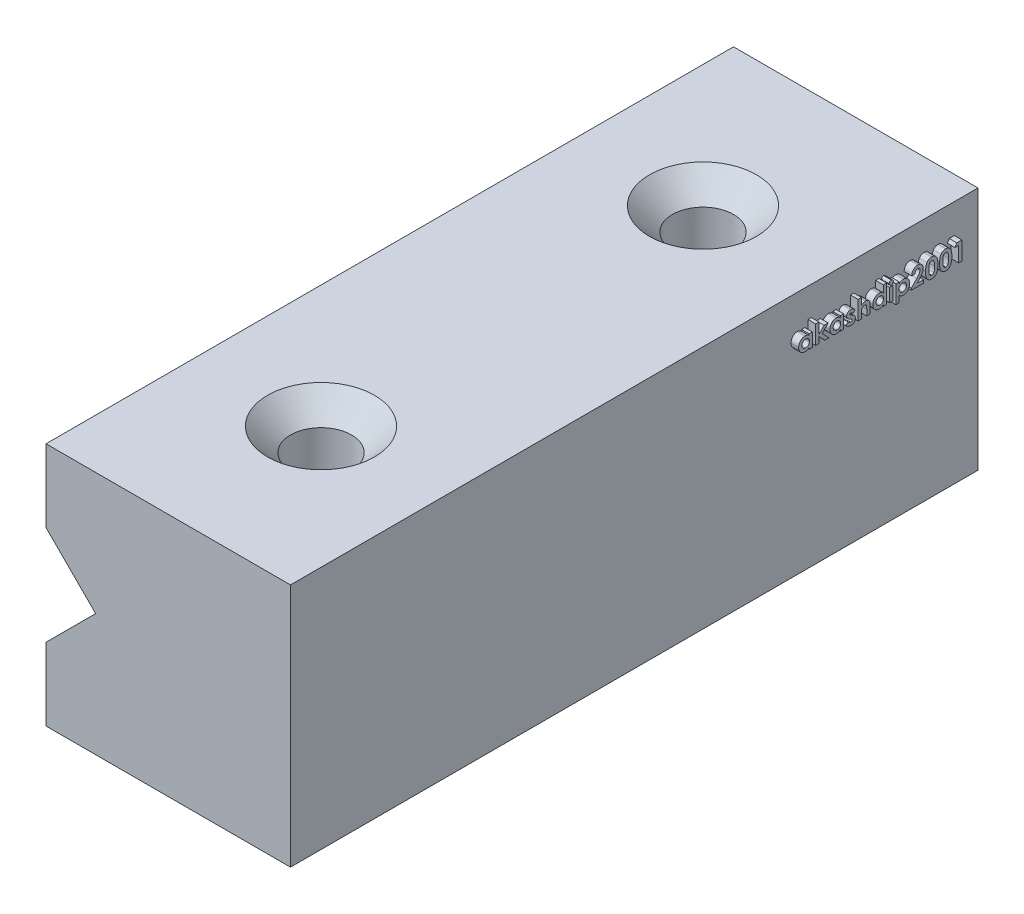
from build123d import *

# Parameters (mm, degrees)
BOSS_EXTRUDE1_DEPTH   = 45
F_8_0MM_DOWEL_HOLE1_D = 8
CHAMFER1_SIZE         = 3
SKETCH8_W             = 0.427403847
SKETCH8_H             = 1.74014423
BOSS_EXTRUDE2_DEPTH   = 1


with BuildPart() as part:
    # Sketch2 → Boss-Extrude1 (new, symmetric)
    with BuildSketch(Plane.XY):
        Polygon((-16, -6.5), (-16, -16), (16, -16), (16, 16), (-16, 16), (-16, 6.5), (-9.5, 0), align=None)
    extrude(amount=BOSS_EXTRUDE1_DEPTH, both=True)

    # Ø8.0mm Dowel Hole1 (through all)
    with Locations(Plane(origin=(0, 16, 0), x_dir=(1, 0, 0), z_dir=(0, 1, 0))):
        with Locations((0, -25), (0, 25)):
            Hole(F_8_0MM_DOWEL_HOLE1_D / 2)

    # Chamfer1
    chamfer1_edges = [part.edges().sort_by_distance(p)[0] for p in [
        (4, 16, -25),
        (4, 16, 25),
    ]]
    chamfer(chamfer1_edges, length=CHAMFER1_SIZE)

    # Sketch8 → Boss-Extrude2 (add, symmetric)
    # profile 1 of 13: a face of its own
    with BuildSketch(Plane(origin=(16, 0, 0), x_dir=(0, 0, -1), z_dir=(1, 0, 0))):
        with BuildLine():
            Line((21.898857493, 11.512698723), (22.32626134, 11.512698723))
            Line((22.32626134, 11.512698723), (22.32626134, 9.772554493))
            Line((22.32626134, 9.772554493), (21.898857493, 9.772554493))
            Line((21.898857493, 9.772554493), (21.898857493, 9.962405755))
            add(Edge.make_bspline(
                [(21.898857493, 9.962405755), (21.87767979, 9.943925835), (21.836578051, 9.908059962), (21.771815009, 9.861523079), (21.706862722, 9.823136165), (21.641409093, 9.792563081), (21.574448126, 9.769988006), (21.505497729, 9.753643124), (21.433564944, 9.744004147), (21.384666028, 9.742692016), (21.359832553, 9.742025646)],
                knots=[0, 0, 0, 0, 1.129196829, 2.191548051, 3.199897424, 4.157751732, 5.089409408, 6.034969131, 7.002052659, 8, 8, 8, 8], degree=3))
            add(Edge.make_bspline(
                [(21.359832553, 9.742025646), (21.331955875, 9.742652785), (21.276869977, 9.743892045), (21.196037539, 9.75693726), (21.117985783, 9.776905869), (21.042778067, 9.805163948), (20.970551224, 9.841780877), (20.900752499, 9.885801271), (20.834578456, 9.938770508), (20.771478217, 9.998396746), (20.713704018, 10.063986031), (20.663197267, 10.134627993), (20.62062383, 10.209320734), (20.585745691, 10.28781661), (20.55830953, 10.370058012), (20.538751474, 10.456305783), (20.527212198, 10.546590728), (20.525783961, 10.608089296), (20.525059416, 10.639287515)],
                knots=[0, 0, 0, 0, 0.980476535, 1.937477201, 2.874147792, 3.812856188, 4.758993464, 5.720109578, 6.712210464, 7.737600662, 8.772720504, 9.783789959, 10.789002326, 11.793715968, 12.802552247, 13.835794126, 14.902098527, 16, 16, 16, 16], degree=3))
            add(Edge.make_bspline(
                [(20.525059416, 10.639287515), (20.525819829, 10.671593312), (20.527311462, 10.734964732), (20.538222672, 10.827959278), (20.557419808, 10.916345556), (20.583596484, 11.000245994), (20.617268232, 11.079675086), (20.658278171, 11.154762963), (20.707184204, 11.225313357), (20.763539736, 11.290125451), (20.82438987, 11.349528866), (20.889488755, 11.401244249), (20.957818389, 11.445178873), (21.029451382, 11.481046576), (21.104377506, 11.508763322), (21.182300953, 11.529026527), (21.263567648, 11.541185161), (21.31892718, 11.542541113), (21.346953196, 11.54322757)],
                knots=[0, 0, 0, 0, 1.136281865, 2.228943489, 3.287578264, 4.313574083, 5.316051562, 6.317280042, 7.318008486, 8.329309503, 9.333984563, 10.305318864, 11.248632312, 12.186624717, 13.117503092, 14.05354244, 15.014596925, 16, 16, 16, 16], degree=3))
            add(Edge.make_bspline(
                [(21.346953196, 11.54322757), (21.372914369, 11.542688221), (21.424282172, 11.541621044), (21.499785442, 11.530033546), (21.573012723, 11.512508277), (21.643564558, 11.487537924), (21.712019636, 11.456007773), (21.777200487, 11.416498145), (21.840533001, 11.370669609), (21.879175792, 11.334876553), (21.898857493, 11.316646289)],
                knots=[0, 0, 0, 0, 1.017011718, 2.012299608, 2.98747302, 3.965332399, 4.941441765, 5.936729654, 6.94912688, 8, 8, 8, 8], degree=3))
            Line((21.898857493, 11.316646289), (21.898857493, 11.512698723))
        make_face()
        with BuildLine():
            add(Edge.make_bspline(
                [(21.436631682, 11.14635257), (21.419600899, 11.145830006), (21.386221675, 11.144805817), (21.337132959, 11.138645243), (21.290218873, 11.127790039), (21.245814003, 11.111753806), (21.203256556, 11.092219338), (21.16319277, 11.067752737), (21.12529199, 11.038833736), (21.089777112, 11.006162461), (21.057400068, 10.970250757), (21.029489166, 10.931063308), (21.005769409, 10.889655991), (20.985708659, 10.84590431), (20.971349714, 10.799290548), (20.959977435, 10.750421531), (20.954075958, 10.698898026), (20.953006207, 10.663786353), (20.952463263, 10.645965701)],
                knots=[0, 0, 0, 0, 1.04836806, 2.054732945, 3.03993516, 4.00574415, 4.955904794, 5.917688631, 6.888591924, 7.88601754, 8.884115178, 9.859153345, 10.841239365, 11.818093293, 12.814750328, 13.83810466, 14.90274714, 16, 16, 16, 16], degree=3))
            add(Edge.make_bspline(
                [(20.952463263, 10.645965701), (20.952997913, 10.627983405), (20.954051435, 10.5925495), (20.960072856, 10.540591376), (20.971035913, 10.491008498), (20.987030601, 10.44420171), (21.006563824, 10.399539434), (21.030340149, 10.35722779), (21.059545201, 10.318014901), (21.091950627, 10.280972858), (21.128194087, 10.247895752), (21.166309326, 10.218526318), (21.206816967, 10.193952932), (21.249277532, 10.174092565), (21.293548096, 10.157908036), (21.340183677, 10.14718926), (21.388727423, 10.140336949), (21.421820976, 10.13938272), (21.438539735, 10.138900646)],
                knots=[0, 0, 0, 0, 1.099136573, 2.165835871, 3.191374663, 4.196217796, 5.183857741, 6.167377911, 7.154730987, 8.166690795, 9.170734848, 10.148332609, 11.103258353, 12.059567475, 13.009337315, 13.978056681, 14.978520572, 16, 16, 16, 16], degree=3))
            add(Edge.make_bspline(
                [(21.438539735, 10.138900646), (21.455887737, 10.139426139), (21.48989925, 10.140456391), (21.539788824, 10.146560742), (21.587333135, 10.157455748), (21.632334373, 10.173583792), (21.67547989, 10.192978042), (21.716380336, 10.216966546), (21.75459188, 10.245819186), (21.790308046, 10.27878581), (21.823035026, 10.314990755), (21.851331913, 10.354692086), (21.875979537, 10.396620045), (21.89536376, 10.441765964), (21.91075755, 10.489339998), (21.92180224, 10.539637402), (21.927809911, 10.592712404), (21.92885422, 10.628938161), (21.92938634, 10.64739674)],
                knots=[0, 0, 0, 0, 1.050008698, 2.058587853, 3.036635738, 3.995319155, 4.947022481, 5.895997462, 6.858296291, 7.838991643, 8.833936038, 9.806048392, 10.784806122, 11.771666913, 12.772873988, 13.80724452, 14.882696879, 16, 16, 16, 16], degree=3))
            add(Edge.make_bspline(
                [(21.92938634, 10.64739674), (21.928860832, 10.665537841), (21.927834362, 10.70097268), (21.921776331, 10.752939501), (21.91065323, 10.802249294), (21.895576269, 10.848992697), (21.875847195, 10.893062833), (21.851180922, 10.933971068), (21.823194435, 10.97313472), (21.79010512, 11.008361568), (21.754582437, 11.041089488), (21.715808931, 11.069069604), (21.675006176, 11.093183644), (21.631923482, 11.112982201), (21.58616192, 11.127495294), (21.538536359, 11.13873225), (21.488303741, 11.144802119), (21.454136778, 11.145827319), (21.436631682, 11.14635257)],
                knots=[0, 0, 0, 0, 1.106611376, 2.161533483, 3.185006901, 4.184773755, 5.152708835, 6.122342771, 7.094156588, 8.082475533, 9.064254463, 10.03606828, 10.992420271, 11.951521816, 12.920622147, 13.915721683, 14.932141191, 16, 16, 16, 16], degree=3))
        make_face(mode=Mode.SUBTRACT)
    # profile 2 of 13: a face of its own
    with BuildSketch(Plane(origin=(16, 0, 0), x_dir=(0, 0, -1), z_dir=(1, 0, 0))):
        Polygon((22.753665186, 12.214862185), (23.181069032, 12.214862185), (23.181069032, 10.790500707), (23.846025462, 11.512698723), (24.374556111, 11.512698723), (23.610380931, 10.683172732), (24.483315126, 9.772554493), (23.945244212, 9.772554493), (23.181069032, 10.569643585), (23.181069032, 9.772554493), (22.753665186, 9.772554493), align=None)
    # profile 3 of 13: a face of its own
    with BuildSketch(Plane(origin=(16, 0, 0), x_dir=(0, 0, -1), z_dir=(1, 0, 0))):
        with BuildLine():
            Line((25.989722878, 11.512698723), (26.417126724, 11.512698723))
            Line((26.417126724, 11.512698723), (26.417126724, 9.772554493))
            Line((26.417126724, 9.772554493), (25.989722878, 9.772554493))
            Line((25.989722878, 9.772554493), (25.989722878, 9.962405755))
            add(Edge.make_bspline(
                [(25.989722878, 9.962405755), (25.968545175, 9.943925835), (25.927443435, 9.908059962), (25.862680394, 9.861523079), (25.797728107, 9.823136165), (25.732274477, 9.792563081), (25.66531351, 9.769988006), (25.596363114, 9.753643124), (25.524430329, 9.744004147), (25.475531412, 9.742692016), (25.450697938, 9.742025646)],
                knots=[0, 0, 0, 0, 1.129196829, 2.191548051, 3.199897424, 4.157751732, 5.089409408, 6.034969131, 7.002052659, 8, 8, 8, 8], degree=3))
            add(Edge.make_bspline(
                [(25.450697938, 9.742025646), (25.422821259, 9.742652785), (25.367735362, 9.743892045), (25.286902923, 9.75693726), (25.208851168, 9.776905869), (25.133643452, 9.805163948), (25.061416608, 9.841780877), (24.991617884, 9.885801271), (24.92544384, 9.938770508), (24.862343602, 9.998396746), (24.804569402, 10.063986031), (24.754062652, 10.134627993), (24.711489214, 10.209320734), (24.676611075, 10.28781661), (24.649174915, 10.370058012), (24.629616859, 10.456305783), (24.618077583, 10.546590728), (24.616649346, 10.608089296), (24.615924801, 10.639287515)],
                knots=[0, 0, 0, 0, 0.980476535, 1.937477201, 2.874147792, 3.812856188, 4.758993464, 5.720109578, 6.712210464, 7.737600662, 8.772720504, 9.783789959, 10.789002326, 11.793715968, 12.802552247, 13.835794126, 14.902098527, 16, 16, 16, 16], degree=3))
            add(Edge.make_bspline(
                [(24.615924801, 10.639287515), (24.616685213, 10.671593312), (24.618176847, 10.734964732), (24.629088056, 10.827959278), (24.648285193, 10.916345556), (24.674461869, 11.000245994), (24.708133617, 11.079675086), (24.749143556, 11.154762963), (24.798049588, 11.225313357), (24.854405121, 11.290125451), (24.915255254, 11.349528866), (24.98035414, 11.401244249), (25.048683773, 11.445178873), (25.120316767, 11.481046576), (25.19524289, 11.508763322), (25.273166337, 11.529026527), (25.354433033, 11.541185161), (25.409792564, 11.542541113), (25.437818581, 11.54322757)],
                knots=[0, 0, 0, 0, 1.136281865, 2.228943489, 3.287578264, 4.313574083, 5.316051562, 6.317280042, 7.318008486, 8.329309503, 9.333984563, 10.305318864, 11.248632312, 12.186624717, 13.117503092, 14.05354244, 15.014596925, 16, 16, 16, 16], degree=3))
            add(Edge.make_bspline(
                [(25.437818581, 11.54322757), (25.463779754, 11.542688221), (25.515147557, 11.541621044), (25.590650826, 11.530033546), (25.663878108, 11.512508277), (25.734429943, 11.487537924), (25.802885021, 11.456007773), (25.868065872, 11.416498145), (25.931398386, 11.370669609), (25.970041177, 11.334876553), (25.989722878, 11.316646289)],
                knots=[0, 0, 0, 0, 1.017011718, 2.012299608, 2.98747302, 3.965332399, 4.941441765, 5.936729654, 6.94912688, 8, 8, 8, 8], degree=3))
            Line((25.989722878, 11.316646289), (25.989722878, 11.512698723))
        make_face()
        with BuildLine():
            add(Edge.make_bspline(
                [(25.527497067, 11.14635257), (25.510466283, 11.145830006), (25.47708706, 11.144805817), (25.427998344, 11.138645243), (25.381084258, 11.127790039), (25.336679388, 11.111753806), (25.29412194, 11.092219338), (25.254058155, 11.067752737), (25.216157374, 11.038833736), (25.180642496, 11.006162461), (25.148265452, 10.970250757), (25.120354551, 10.931063308), (25.096634794, 10.889655991), (25.076574044, 10.84590431), (25.062215098, 10.799290548), (25.050842819, 10.750421531), (25.044941343, 10.698898026), (25.043871591, 10.663786353), (25.043328647, 10.645965701)],
                knots=[0, 0, 0, 0, 1.04836806, 2.054732945, 3.03993516, 4.00574415, 4.955904794, 5.917688631, 6.888591924, 7.88601754, 8.884115178, 9.859153345, 10.841239365, 11.818093293, 12.814750328, 13.83810466, 14.90274714, 16, 16, 16, 16], degree=3))
            add(Edge.make_bspline(
                [(25.043328647, 10.645965701), (25.043863298, 10.627983405), (25.04491682, 10.5925495), (25.05093824, 10.540591376), (25.061901298, 10.491008498), (25.077895985, 10.44420171), (25.097429208, 10.399539434), (25.121205534, 10.35722779), (25.150410585, 10.318014901), (25.182816011, 10.280972858), (25.219059472, 10.247895752), (25.25717471, 10.218526318), (25.297682352, 10.193952932), (25.340142916, 10.174092565), (25.38441348, 10.157908036), (25.431049062, 10.14718926), (25.479592807, 10.140336949), (25.51268636, 10.13938272), (25.52940512, 10.138900646)],
                knots=[0, 0, 0, 0, 1.099136573, 2.165835871, 3.191374663, 4.196217796, 5.183857741, 6.167377911, 7.154730987, 8.166690795, 9.170734848, 10.148332609, 11.103258353, 12.059567475, 13.009337315, 13.978056681, 14.978520572, 16, 16, 16, 16], degree=3))
            add(Edge.make_bspline(
                [(25.52940512, 10.138900646), (25.546753121, 10.139426139), (25.580764635, 10.140456391), (25.630654209, 10.146560742), (25.678198519, 10.157455748), (25.723199758, 10.173583792), (25.766345275, 10.192978042), (25.807245721, 10.216966546), (25.845457265, 10.245819186), (25.88117343, 10.27878581), (25.913900411, 10.314990755), (25.942197298, 10.354692086), (25.966844922, 10.396620045), (25.986229144, 10.441765964), (26.001622935, 10.489339998), (26.012667625, 10.539637402), (26.018675296, 10.592712404), (26.019719604, 10.628938161), (26.020251724, 10.64739674)],
                knots=[0, 0, 0, 0, 1.050008698, 2.058587853, 3.036635738, 3.995319155, 4.947022481, 5.895997462, 6.858296291, 7.838991643, 8.833936038, 9.806048392, 10.784806122, 11.771666913, 12.772873988, 13.80724452, 14.882696879, 16, 16, 16, 16], degree=3))
            add(Edge.make_bspline(
                [(26.020251724, 10.64739674), (26.019726216, 10.665537841), (26.018699747, 10.70097268), (26.012641715, 10.752939501), (26.001518615, 10.802249294), (25.986441653, 10.848992697), (25.96671258, 10.893062833), (25.942046307, 10.933971068), (25.91405982, 10.97313472), (25.880970505, 11.008361568), (25.845447822, 11.041089488), (25.806674315, 11.069069604), (25.765871561, 11.093183644), (25.722788866, 11.112982201), (25.677027304, 11.127495294), (25.629401743, 11.13873225), (25.579169126, 11.144802119), (25.545002163, 11.145827319), (25.527497067, 11.14635257)],
                knots=[0, 0, 0, 0, 1.106611376, 2.161533483, 3.185006901, 4.184773755, 5.152708835, 6.122342771, 7.094156588, 8.082475533, 9.064254463, 10.03606828, 10.992420271, 11.951521816, 12.920622147, 13.915721683, 14.932141191, 16, 16, 16, 16], degree=3))
        make_face(mode=Mode.SUBTRACT)
    # profile 4 of 13: a face of its own
    with BuildSketch(Plane(origin=(16, 0, 0), x_dir=(0, 0, -1), z_dir=(1, 0, 0))):
        with BuildLine():
            Line((27.913040186, 11.24414028), (27.65163694, 10.963179493))
            add(Edge.make_bspline(
                [(27.65163694, 10.963179493), (27.638583824, 10.977623474), (27.613618157, 11.005249338), (27.575398134, 11.042909565), (27.537747281, 11.074269409), (27.50136722, 11.100612985), (27.46551494, 11.120815359), (27.430488453, 11.135350514), (27.396270954, 11.144577647), (27.37359015, 11.145772064), (27.362566928, 11.14635257)],
                knots=[0, 0, 0, 0, 1.327646587, 2.539285, 3.655602211, 4.666613517, 5.598770349, 6.454635452, 7.248928967, 8, 8, 8, 8], degree=3))
            add(Edge.make_bspline(
                [(27.362566928, 11.14635257), (27.351412536, 11.146012622), (27.330055344, 11.145361728), (27.29991556, 11.139778689), (27.273435743, 11.130113421), (27.251029129, 11.116938759), (27.233027258, 11.100708929), (27.220423309, 11.082142386), (27.211959641, 11.061816594), (27.21124367, 11.047378398), (27.210876724, 11.039978621)],
                knots=[0, 0, 0, 0, 1.295068245, 2.479652818, 3.543291146, 4.55379989, 5.481948265, 6.332409746, 7.145336708, 8, 8, 8, 8], degree=3))
            add(Edge.make_bspline(
                [(27.210876724, 11.039978621), (27.212119969, 11.028764761), (27.214699557, 11.005497304), (27.23241775, 10.978510525), (27.2558602, 10.958602931), (27.282882565, 10.940077771), (27.319477844, 10.919364659), (27.347239951, 10.905181786), (27.362566928, 10.897351668)],
                knots=[0, 0, 0, 0, 0.916701701, 1.902049539, 2.5493345, 3.440293453, 4.586830489, 6, 6, 6, 6], degree=3))
            Line((27.362566928, 10.897351668), (27.517119212, 10.8191215))
            add(Edge.make_bspline(
                [(27.517119212, 10.8191215), (27.536781218, 10.809137772), (27.574929202, 10.789767465), (27.628561694, 10.758510873), (27.678097519, 10.72821474), (27.722543002, 10.697165295), (27.762170179, 10.665901972), (27.796697579, 10.634115617), (27.826962666, 10.602813919), (27.860712486, 10.560846899), (27.894472435, 10.504950242), (27.922617748, 10.432259245), (27.940565672, 10.35442317), (27.942551403, 10.300549855), (27.943569032, 10.272941362)],
                knots=[0, 0, 0, 0, 1.076693506, 2.088987655, 3.030641824, 3.911722491, 4.735175175, 5.493635918, 6.202154166, 6.859459289, 8.120623445, 9.372284821, 10.653373066, 12, 12, 12, 12], degree=3))
            add(Edge.make_bspline(
                [(27.943569032, 10.272941362), (27.942955904, 10.254315498), (27.94175585, 10.21785974), (27.934169361, 10.164200339), (27.920542063, 10.113178194), (27.902608559, 10.063997971), (27.878452667, 10.017548998), (27.84912623, 9.973606108), (27.815092324, 9.931592353), (27.775451213, 9.892944941), (27.73202504, 9.856925977), (27.683749519, 9.826631441), (27.632759185, 9.799995582), (27.577706954, 9.779195347), (27.519365278, 9.762331883), (27.457234047, 9.750645925), (27.391524085, 9.743291652), (27.346527889, 9.742454814), (27.323451844, 9.742025646)],
                knots=[0, 0, 0, 0, 0.976600749, 1.911466839, 2.833459288, 3.740827163, 4.650527853, 5.570709661, 6.506801416, 7.479409329, 8.468875524, 9.458587492, 10.461481786, 11.480119772, 12.538142914, 13.641687514, 14.790552763, 16, 16, 16, 16], degree=3))
            add(Edge.make_bspline(
                [(27.323451844, 9.742025646), (27.292878067, 9.742999251), (27.232864433, 9.744910352), (27.145218865, 9.758222807), (27.062458182, 9.781266892), (26.984514292, 9.813548706), (26.910909802, 9.854684587), (26.842695865, 9.90572521), (26.778689932, 9.965340752), (26.741450614, 10.011063097), (26.722415186, 10.034434751)],
                knots=[0, 0, 0, 0, 1.056901255, 2.07460411, 3.05625841, 4.019970729, 4.984811261, 5.963335951, 6.958928997, 8, 8, 8, 8], degree=3))
            Line((26.722415186, 10.034434751), (26.981433365, 10.322073723))
            add(Edge.make_bspline(
                [(26.981433365, 10.322073723), (26.994053605, 10.308762615), (27.01910891, 10.282335712), (27.061342029, 10.247488267), (27.106027659, 10.215727385), (27.15366326, 10.189058606), (27.201308486, 10.167524768), (27.24702015, 10.151371377), (27.289936763, 10.141220061), (27.317840039, 10.139647193), (27.331084056, 10.138900646)],
                knots=[0, 0, 0, 0, 1.087861918, 2.159761696, 3.243809206, 4.338405912, 5.394481878, 6.343674753, 7.213841449, 8, 8, 8, 8], degree=3))
            add(Edge.make_bspline(
                [(27.331084056, 10.138900646), (27.344320904, 10.139283994), (27.369765778, 10.140020895), (27.405929533, 10.147686108), (27.437983136, 10.160572462), (27.465165785, 10.17843972), (27.487775584, 10.198948603), (27.503706657, 10.222257069), (27.514241126, 10.246972914), (27.515521467, 10.264253293), (27.516165186, 10.272941362)],
                knots=[0, 0, 0, 0, 1.255011871, 2.412479185, 3.488767498, 4.514443302, 5.48617286, 6.365347346, 7.178144445, 8, 8, 8, 8], degree=3))
            add(Edge.make_bspline(
                [(27.516165186, 10.272941362), (27.515590798, 10.281123008), (27.51441147, 10.297921504), (27.50507469, 10.322717287), (27.490415762, 10.34726909), (27.470084628, 10.371646137), (27.443810758, 10.395650637), (27.411688178, 10.419090321), (27.374457957, 10.443215725), (27.346957597, 10.457615361), (27.332515096, 10.46517769)],
                knots=[0, 0, 0, 0, 0.704666567, 1.446816302, 2.258757648, 3.165368109, 4.175243826, 5.322435858, 6.59381024, 8, 8, 8, 8], degree=3))
            Line((27.332515096, 10.46517769), (27.190842169, 10.536729673))
            add(Edge.make_bspline(
                [(27.190842169, 10.536729673), (27.158705094, 10.553962858), (27.097013958, 10.587044113), (27.013630605, 10.643771435), (26.943058634, 10.704158797), (26.885240535, 10.76788178), (26.839170959, 10.83476156), (26.807034339, 10.905649648), (26.78681747, 10.979874009), (26.78459329, 11.030629433), (26.783472878, 11.056197071)],
                knots=[0, 0, 0, 0, 1.255999728, 2.41104856, 3.467751088, 4.449286722, 5.368722015, 6.253902015, 7.120417131, 8, 8, 8, 8], degree=3))
            add(Edge.make_bspline(
                [(26.783472878, 11.056197071), (26.783861428, 11.072767611), (26.784624214, 11.105298272), (26.792744531, 11.153071804), (26.805012587, 11.198994312), (26.822324136, 11.243138727), (26.844499929, 11.285548851), (26.871669121, 11.326036472), (26.904163176, 11.364527982), (26.940941822, 11.400899392), (26.981748883, 11.434024401), (27.025418441, 11.463380906), (27.071821328, 11.488387189), (27.121338367, 11.508323976), (27.17334017, 11.524192418), (27.228170003, 11.534978653), (27.285593938, 11.541838736), (27.324862751, 11.542758066), (27.344917439, 11.54322757)],
                knots=[0, 0, 0, 0, 0.959035663, 1.882742823, 2.798841253, 3.708806893, 4.623422363, 5.566085165, 6.527241613, 7.536786942, 8.55815439, 9.567237405, 10.580975912, 11.605536372, 12.654523293, 13.725718749, 14.838518481, 16, 16, 16, 16], degree=3))
            add(Edge.make_bspline(
                [(27.344917439, 11.54322757), (27.372643175, 11.542314724), (27.42767387, 11.540502886), (27.508833321, 11.525841487), (27.587224933, 11.501199058), (27.662628937, 11.467245912), (27.734075401, 11.424576456), (27.799993184, 11.372761326), (27.860828395, 11.313076446), (27.895463431, 11.267347185), (27.913040186, 11.24414028)],
                knots=[0, 0, 0, 0, 0.996590028, 1.978055413, 2.954661574, 3.945146934, 4.945404762, 5.939399542, 6.954276554, 8, 8, 8, 8], degree=3))
        make_face()
    # profile 5 of 13: a face of its own
    with BuildSketch(Plane(origin=(16, 0, 0), x_dir=(0, 0, -1), z_dir=(1, 0, 0))):
        with BuildLine():
            Line((28.309915186, 12.214862185), (28.737319032, 12.214862185))
            Line((28.737319032, 12.214862185), (28.737319032, 11.324278501))
            add(Edge.make_bspline(
                [(28.737319032, 11.324278501), (28.758848269, 11.341787349), (28.800812484, 11.375915127), (28.866655713, 11.420375524), (28.932362753, 11.458315537), (28.998630853, 11.489063323), (29.065172518, 11.513158563), (29.132102654, 11.530246505), (29.199485694, 11.541457703), (29.244658277, 11.542636985), (29.267280721, 11.54322757)],
                knots=[0, 0, 0, 0, 1.13710654, 2.216417683, 3.252896077, 4.244436563, 5.207303112, 6.149540546, 7.073289332, 8, 8, 8, 8], degree=3))
            add(Edge.make_bspline(
                [(29.267280721, 11.54322757), (29.288928881, 11.542653153), (29.331426037, 11.541525527), (29.393771942, 11.533380517), (29.453486868, 11.519365055), (29.51071792, 11.500098373), (29.565071361, 11.474187524), (29.617253995, 11.443836236), (29.666645562, 11.407472554), (29.696697517, 11.379441654), (29.711857043, 11.365301638)],
                knots=[0, 0, 0, 0, 1.056403236, 2.073808271, 3.062028718, 4.046096703, 5.014652014, 5.995532726, 6.988858718, 8, 8, 8, 8], degree=3))
            add(Edge.make_bspline(
                [(29.711857043, 11.365301638), (29.724307015, 11.352089088), (29.749387596, 11.325472286), (29.78062479, 11.279585536), (29.807597796, 11.229603478), (29.82957695, 11.175056434), (29.845923184, 11.115919015), (29.858578485, 11.052678402), (29.865577135, 10.98464408), (29.866440865, 10.93775398), (29.86688634, 10.913570118)],
                knots=[0, 0, 0, 0, 0.887296576, 1.787466942, 2.706642908, 3.663267187, 4.658426068, 5.705361056, 6.816525637, 8, 8, 8, 8], degree=3))
            Line((29.86688634, 10.913570118), (29.86688634, 9.772554493))
            Line((29.86688634, 9.772554493), (29.439482493, 9.772554493))
            Line((29.439482493, 9.772554493), (29.439482493, 10.529097461))
            add(Edge.make_bspline(
                [(29.439482493, 10.529097461), (29.439399448, 10.553107851), (29.43924049, 10.599066214), (29.437813048, 10.665063631), (29.435481989, 10.72501976), (29.43229416, 10.778952722), (29.427843255, 10.826637121), (29.423465476, 10.868414741), (29.417322427, 10.904085328), (29.40812399, 10.942844809), (29.393154347, 10.984301203), (29.371401019, 11.028491937), (29.342344549, 11.064962875), (29.308718872, 11.095042255), (29.269839729, 11.117999975), (29.227098955, 11.134956149), (29.179765874, 11.144491882), (29.146956712, 11.14571614), (29.129900913, 11.14635257)],
                knots=[0, 0, 0, 0, 1.461461505, 2.797388094, 4.017818807, 5.113567707, 6.085313608, 6.932873269, 7.669572396, 8.286941306, 9.355291607, 10.346554054, 11.270113241, 12.175128673, 13.078071705, 14.003657132, 14.962203834, 16, 16, 16, 16], degree=3))
            add(Edge.make_bspline(
                [(29.129900913, 11.14635257), (29.10768226, 11.145483969), (29.064164523, 11.143782718), (29.001758164, 11.126270366), (28.944196507, 11.098589872), (28.892151352, 11.060225953), (28.846799522, 11.012173616), (28.808801687, 10.955851479), (28.777721539, 10.891822884), (28.764288139, 10.845132126), (28.757353587, 10.821029553)],
                knots=[0, 0, 0, 0, 0.993549393, 1.945978497, 2.879753144, 3.843180486, 4.826017097, 5.826060929, 6.877775219, 8, 8, 8, 8], degree=3))
            add(Edge.make_bspline(
                [(28.757353587, 10.821029553), (28.755626869, 10.813579798), (28.751689386, 10.796591919), (28.748673987, 10.76760768), (28.744199183, 10.732570702), (28.742646946, 10.691271024), (28.739739237, 10.643772347), (28.73869351, 10.589997821), (28.737640729, 10.52989689), (28.737429711, 10.487757142), (28.737319032, 10.465654703)],
                knots=[0, 0, 0, 0, 0.514379255, 1.17295301, 1.959069106, 2.891908278, 3.953016936, 5.163065833, 6.51201855, 8, 8, 8, 8], degree=3))
            Line((28.737319032, 10.465654703), (28.737319032, 9.772554493))
            Line((28.737319032, 9.772554493), (28.309915186, 9.772554493))
            Line((28.309915186, 9.772554493), (28.309915186, 12.214862185))
        make_face()
    # profile 6 of 13: a face of its own
    with BuildSketch(Plane(origin=(16, 0, 0), x_dir=(0, 0, -1), z_dir=(1, 0, 0))):
        with BuildLine():
            Line((31.60703057, 12.214862185), (32.034434416, 12.214862185))
            Line((32.034434416, 12.214862185), (32.034434416, 9.772554493))
            Line((32.034434416, 9.772554493), (31.60703057, 9.772554493))
            Line((31.60703057, 9.772554493), (31.60703057, 9.962405755))
            add(Edge.make_bspline(
                [(31.60703057, 9.962405755), (31.585852867, 9.943925835), (31.544751128, 9.908059962), (31.479988086, 9.861523079), (31.415035799, 9.823136165), (31.34958217, 9.792563081), (31.282621203, 9.769988006), (31.213670806, 9.753643124), (31.141738021, 9.744004147), (31.092839105, 9.742692016), (31.06800563, 9.742025646)],
                knots=[0, 0, 0, 0, 1.129196829, 2.191548051, 3.199897424, 4.157751732, 5.089409408, 6.034969131, 7.002052659, 8, 8, 8, 8], degree=3))
            add(Edge.make_bspline(
                [(31.06800563, 9.742025646), (31.040128952, 9.742652785), (30.985043054, 9.743892045), (30.904210616, 9.75693726), (30.82615886, 9.776905869), (30.750951144, 9.805163948), (30.678724301, 9.841780877), (30.608925576, 9.885801271), (30.542751533, 9.938770508), (30.479651294, 9.998396746), (30.421877095, 10.063986031), (30.371370344, 10.134627993), (30.328796907, 10.209320734), (30.293918768, 10.28781661), (30.266482607, 10.370058012), (30.246924551, 10.456305783), (30.235385275, 10.546590728), (30.233957038, 10.608089296), (30.233232493, 10.639287515)],
                knots=[0, 0, 0, 0, 0.980476535, 1.937477201, 2.874147792, 3.812856188, 4.758993464, 5.720109578, 6.712210464, 7.737600662, 8.772720504, 9.783789959, 10.789002326, 11.793715968, 12.802552247, 13.835794126, 14.902098527, 16, 16, 16, 16], degree=3))
            add(Edge.make_bspline(
                [(30.233232493, 10.639287515), (30.233992906, 10.671593312), (30.235484539, 10.734964732), (30.246395748, 10.827959278), (30.265592885, 10.916345556), (30.291769561, 11.000245994), (30.325441309, 11.079675086), (30.366451248, 11.154762963), (30.415357281, 11.225313357), (30.471712813, 11.290125451), (30.532562947, 11.349528866), (30.597661832, 11.401244249), (30.665991465, 11.445178873), (30.737624459, 11.481046576), (30.812550583, 11.508763322), (30.89047403, 11.529026527), (30.971740725, 11.541185161), (31.027100256, 11.542541113), (31.055126273, 11.54322757)],
                knots=[0, 0, 0, 0, 1.136281865, 2.228943489, 3.287578264, 4.313574083, 5.316051562, 6.317280042, 7.318008486, 8.329309503, 9.333984563, 10.305318864, 11.248632312, 12.186624717, 13.117503092, 14.05354244, 15.014596925, 16, 16, 16, 16], degree=3))
            add(Edge.make_bspline(
                [(31.055126273, 11.54322757), (31.081070709, 11.542404435), (31.132375832, 11.540776686), (31.208162337, 11.530530412), (31.281083347, 11.511237573), (31.352024487, 11.486380168), (31.420064449, 11.45293058), (31.485568782, 11.412749616), (31.54871008, 11.36532699), (31.587344643, 11.328654349), (31.60703057, 11.309968104)],
                knots=[0, 0, 0, 0, 1.011899165, 2.001030639, 2.974036179, 3.948778736, 4.92769327, 5.924124564, 6.942254589, 8, 8, 8, 8], degree=3))
            Line((31.60703057, 11.309968104), (31.60703057, 12.214862185))
        make_face()
        with BuildLine():
            add(Edge.make_bspline(
                [(31.144804759, 11.14635257), (31.127773976, 11.145830006), (31.094394752, 11.144805817), (31.045306036, 11.138645243), (30.99839195, 11.127790039), (30.95398708, 11.111753806), (30.911429633, 11.092219338), (30.871365847, 11.067752737), (30.833465067, 11.038833736), (30.797950189, 11.006162461), (30.765573145, 10.970250757), (30.737662243, 10.931063308), (30.713942486, 10.889655991), (30.693881736, 10.84590431), (30.679522791, 10.799290548), (30.668150512, 10.750421531), (30.662249035, 10.698898026), (30.661179283, 10.663786353), (30.66063634, 10.645965701)],
                knots=[0, 0, 0, 0, 1.04836806, 2.054732945, 3.03993516, 4.00574415, 4.955904794, 5.917688631, 6.888591924, 7.88601754, 8.884115178, 9.859153345, 10.841239365, 11.818093293, 12.814750328, 13.83810466, 14.90274714, 16, 16, 16, 16], degree=3))
            add(Edge.make_bspline(
                [(30.66063634, 10.645965701), (30.66117099, 10.627983405), (30.662224512, 10.5925495), (30.668245933, 10.540591376), (30.67920899, 10.491008498), (30.695203677, 10.44420171), (30.714736901, 10.399539434), (30.738513226, 10.35722779), (30.767718278, 10.318014901), (30.800123704, 10.280972858), (30.836367164, 10.247895752), (30.874482403, 10.218526318), (30.914990044, 10.193952932), (30.957450609, 10.174092565), (31.001721173, 10.157908036), (31.048356754, 10.14718926), (31.0969005, 10.140336949), (31.129994053, 10.13938272), (31.146712812, 10.138900646)],
                knots=[0, 0, 0, 0, 1.099136573, 2.165835871, 3.191374663, 4.196217796, 5.183857741, 6.167377911, 7.154730987, 8.166690795, 9.170734848, 10.148332609, 11.103258353, 12.059567475, 13.009337315, 13.978056681, 14.978520572, 16, 16, 16, 16], degree=3))
            add(Edge.make_bspline(
                [(31.146712812, 10.138900646), (31.164060813, 10.139426139), (31.198072327, 10.140456391), (31.247961901, 10.146560742), (31.295506212, 10.157455748), (31.34050745, 10.173583792), (31.383652967, 10.192978042), (31.424553413, 10.216966546), (31.462764957, 10.245819186), (31.498481122, 10.27878581), (31.531208103, 10.314990755), (31.55950499, 10.354692086), (31.584152614, 10.396620045), (31.603536836, 10.441765964), (31.618930627, 10.489339998), (31.629975317, 10.539637402), (31.635982988, 10.592712404), (31.637027296, 10.628938161), (31.637559416, 10.64739674)],
                knots=[0, 0, 0, 0, 1.050008698, 2.058587853, 3.036635738, 3.995319155, 4.947022481, 5.895997462, 6.858296291, 7.838991643, 8.833936038, 9.806048392, 10.784806122, 11.771666913, 12.772873988, 13.80724452, 14.882696879, 16, 16, 16, 16], degree=3))
            add(Edge.make_bspline(
                [(31.637559416, 10.64739674), (31.637033909, 10.665537841), (31.636007439, 10.70097268), (31.629949408, 10.752939501), (31.618826307, 10.802249294), (31.603749346, 10.848992697), (31.584020272, 10.893062833), (31.559353999, 10.933971068), (31.531367512, 10.97313472), (31.498278197, 11.008361568), (31.462755514, 11.041089488), (31.423982008, 11.069069604), (31.383179253, 11.093183644), (31.340096559, 11.112982201), (31.294334997, 11.127495294), (31.246709436, 11.13873225), (31.196476818, 11.144802119), (31.162309855, 11.145827319), (31.144804759, 11.14635257)],
                knots=[0, 0, 0, 0, 1.106611376, 2.161533483, 3.185006901, 4.184773755, 5.152708835, 6.122342771, 7.094156588, 8.082475533, 9.064254463, 10.03606828, 10.992420271, 11.951521816, 12.920622147, 13.915721683, 14.932141191, 16, 16, 16, 16], degree=3))
        make_face(mode=Mode.SUBTRACT)
    # profile 7 of 13: a face of its own
    with BuildSketch(Plane(origin=(16, 0, 0), x_dir=(0, 0, -1), z_dir=(1, 0, 0))):
        with BuildLine():
            add(Edge.make_bspline(
                [(32.644057313, 12.245391031), (32.662478416, 12.244487222), (32.698650026, 12.242712506), (32.75047078, 12.225412972), (32.798031729, 12.19826187), (32.840076928, 12.161009911), (32.875046192, 12.116524259), (32.901764009, 12.066719614), (32.916647391, 12.01153767), (32.918714473, 11.973418561), (32.919770955, 11.953935953)],
                knots=[0, 0, 0, 0, 0.989868614, 1.943702388, 2.910836514, 3.924849579, 4.949916355, 5.946401046, 6.950409252, 8, 8, 8, 8], degree=3))
            add(Edge.make_bspline(
                [(32.919770955, 11.953935953), (32.918752272, 11.934596921), (32.916767321, 11.896913895), (32.901421459, 11.842481073), (32.875776002, 11.792700617), (32.840523508, 11.74887566), (32.798934135, 11.712223666), (32.752412429, 11.684579652), (32.701088268, 11.668242487), (32.665477932, 11.666319415), (32.647396406, 11.665342954)],
                knots=[0, 0, 0, 0, 1.05296456, 2.051751585, 3.055639087, 4.085634717, 5.099016424, 6.062201612, 7.016062274, 8, 8, 8, 8], degree=3))
            add(Edge.make_bspline(
                [(32.647396406, 11.665342954), (32.628814502, 11.666243532), (32.5923282, 11.668011853), (32.54008241, 11.685351864), (32.491887119, 11.712289133), (32.450024312, 11.750302207), (32.414654571, 11.795103964), (32.389103799, 11.846068104), (32.373121159, 11.90162738), (32.371224034, 11.940311059), (32.370251724, 11.960137125)],
                knots=[0, 0, 0, 0, 0.989065327, 1.942068821, 2.907541208, 3.917690034, 4.939857478, 5.938239964, 6.943311734, 8, 8, 8, 8], degree=3))
            add(Edge.make_bspline(
                [(32.370251724, 11.960137125), (32.371309863, 11.979147769), (32.373388425, 12.016491435), (32.388360961, 12.070446521), (32.414466139, 12.119413873), (32.449183516, 12.163085174), (32.490859416, 12.199642243), (32.538391814, 12.225968748), (32.589863813, 12.242553762), (32.625806288, 12.244435509), (32.644057313, 12.245391031)],
                knots=[0, 0, 0, 0, 1.038616768, 2.040212704, 3.031499824, 4.052181184, 5.074969369, 6.039807101, 7.004644834, 8, 8, 8, 8], degree=3))
        make_face()
    # profile 8 of 13: a face of its own
    with BuildSketch(Plane(origin=(16, 0, 0), x_dir=(0, 0, -1), z_dir=(1, 0, 0))):
        with Locations((32.64501134, 10.642626608)):
            Rectangle(SKETCH8_W, SKETCH8_H)
    # profile 9 of 13: a face of its own
    with BuildSketch(Plane(origin=(16, 0, 0), x_dir=(0, 0, -1), z_dir=(1, 0, 0))):
        with BuildLine():
            Line((33.682992109, 11.512698723), (33.682992109, 11.316646289))
            add(Edge.make_bspline(
                [(33.682992109, 11.316646289), (33.702834591, 11.334877204), (33.74180318, 11.370680838), (33.805605301, 11.416520177), (33.871171611, 11.455889057), (33.939706822, 11.487554255), (34.01027038, 11.512503924), (34.083494575, 11.530034699), (34.158841059, 11.541596715), (34.210048789, 11.542681159), (34.235850432, 11.54322757)],
                knots=[0, 0, 0, 0, 1.054376801, 2.070687235, 3.070225973, 4.045259405, 5.022040922, 5.996139433, 6.99033025, 8, 8, 8, 8], degree=3))
            add(Edge.make_bspline(
                [(34.235850432, 11.54322757), (34.26387911, 11.542556212), (34.319086511, 11.541233856), (34.400313698, 11.528887759), (34.478155289, 11.508931142), (34.552908116, 11.481066267), (34.624173904, 11.44488838), (34.692753374, 11.401572191), (34.757463794, 11.349330236), (34.81833662, 11.290157463), (34.874645501, 11.225299708), (34.923623857, 11.154785564), (34.964420927, 11.079543131), (34.998998448, 11.000461932), (35.024234512, 10.916230432), (35.043684365, 10.82797854), (35.054522914, 10.734959626), (35.056024632, 10.671591588), (35.056790186, 10.639287515)],
                knots=[0, 0, 0, 0, 0.985987466, 1.942075377, 2.884088208, 3.810275091, 4.743821533, 5.692411115, 6.659945104, 7.665215984, 8.677116751, 9.678438675, 10.680260931, 11.685531812, 12.710472044, 13.769734641, 14.863044265, 16, 16, 16, 16], degree=3))
            add(Edge.make_bspline(
                [(35.056790186, 10.639287515), (35.05606564, 10.608089297), (35.054637402, 10.54659073), (35.043098135, 10.456305774), (35.023540045, 10.370058046), (34.996104008, 10.287816486), (34.961225413, 10.209321196), (34.91865368, 10.134626263), (34.86814048, 10.063992596), (34.810390857, 9.9983717), (34.747291002, 9.938947101), (34.681545475, 9.885631421), (34.611844843, 9.841943403), (34.539931465, 9.805045524), (34.464672434, 9.77683043), (34.3865818, 9.757062585), (34.305783241, 9.743846555), (34.250850063, 9.742638661), (34.222971075, 9.742025646)],
                knots=[0, 0, 0, 0, 1.098553145, 2.165490463, 3.199345634, 4.208780719, 5.21409072, 6.219899742, 7.23156933, 8.267303578, 9.293302409, 10.281606823, 11.243293419, 12.184993323, 13.124258899, 14.066907486, 15.018941492, 16, 16, 16, 16], degree=3))
            add(Edge.make_bspline(
                [(34.222971075, 9.742025646), (34.198127671, 9.742628148), (34.149187659, 9.743815041), (34.07722251, 9.754397692), (34.00770336, 9.770204576), (33.940538247, 9.793995699), (33.874972117, 9.825566318), (33.809888296, 9.864881817), (33.745136286, 9.912912391), (33.704151274, 9.949958366), (33.682992109, 9.96908394)],
                knots=[0, 0, 0, 0, 0.990856396, 1.951927477, 2.896945079, 3.83213376, 4.788585491, 5.796263726, 6.862286081, 8, 8, 8, 8], degree=3))
            Line((33.682992109, 9.96908394), (33.682992109, 9.131448723))
            Line((33.682992109, 9.131448723), (33.255588263, 9.131448723))
            Line((33.255588263, 9.131448723), (33.255588263, 11.512698723))
            Line((33.255588263, 11.512698723), (33.682992109, 11.512698723))
        make_face()
        with BuildLine():
            add(Edge.make_bspline(
                [(34.143309867, 11.14635257), (34.125964544, 11.145819189), (34.091958281, 11.144773473), (34.042030894, 11.138780479), (33.994723816, 11.127504618), (33.94931778, 11.112889948), (33.906387759, 11.093162438), (33.865582535, 11.069248641), (33.82725161, 11.040733263), (33.791196046, 11.008745479), (33.758797256, 10.972759161), (33.730013741, 10.934305914), (33.706133981, 10.892885005), (33.686227599, 10.849021644), (33.671209103, 10.802241236), (33.660069731, 10.752941742), (33.654016188, 10.70097208), (33.652989091, 10.665537638), (33.652463263, 10.64739674)],
                knots=[0, 0, 0, 0, 1.060469436, 2.079096586, 3.066888298, 4.028858836, 4.99004353, 5.948472697, 6.914558426, 7.905691313, 8.889602648, 9.869280844, 10.836099585, 11.806137001, 12.808075328, 13.83377171, 14.890985086, 16, 16, 16, 16], degree=3))
            add(Edge.make_bspline(
                [(33.652463263, 10.64739674), (33.652995708, 10.628938362), (33.654040655, 10.592713001), (33.660043733, 10.539635156), (33.671104919, 10.489347965), (33.686439733, 10.441737414), (33.706007381, 10.396797326), (33.729858848, 10.354361101), (33.758959195, 10.315359132), (33.791002072, 10.27842401), (33.827280576, 10.246008223), (33.86543882, 10.21693572), (33.906377845, 10.192986277), (33.949513031, 10.173581567), (33.994517071, 10.157456359), (34.042060611, 10.146560572), (34.091950396, 10.140456436), (34.125961881, 10.139426155), (34.143309867, 10.138900646)],
                knots=[0, 0, 0, 0, 1.117193555, 2.192540452, 3.22680955, 4.227918444, 5.21468246, 6.188555072, 7.166222992, 8.154674427, 9.142376254, 10.104580718, 11.053462639, 12.005072638, 12.963662044, 13.941614018, 14.950094269, 16, 16, 16, 16], degree=3))
            add(Edge.make_bspline(
                [(34.143309867, 10.138900646), (34.160026826, 10.139388827), (34.193116816, 10.140355146), (34.241533076, 10.147097775), (34.288073164, 10.158115901), (34.33237261, 10.173820717), (34.374701082, 10.19426837), (34.415443926, 10.21819551), (34.453194546, 10.248090684), (34.489433961, 10.280948033), (34.521858556, 10.318001673), (34.550947315, 10.357366285), (34.575382736, 10.399393206), (34.594783885, 10.444221804), (34.610823368, 10.49100296), (34.621774029, 10.540592931), (34.627798882, 10.592549091), (34.62885193, 10.627983267), (34.62938634, 10.645965701)],
                knots=[0, 0, 0, 0, 1.021711385, 2.02240246, 2.981887075, 3.941027022, 4.888772411, 5.852236371, 6.822344989, 7.82661704, 8.838806642, 9.826383926, 10.814965113, 11.80282933, 12.807900643, 13.833672313, 14.900613836, 16, 16, 16, 16], degree=3))
            add(Edge.make_bspline(
                [(34.62938634, 10.645965701), (34.628843396, 10.663786353), (34.627773644, 10.698898027), (34.621872167, 10.750421531), (34.610499889, 10.799290549), (34.59614094, 10.845904305), (34.576080202, 10.88965601), (34.552360402, 10.931063238), (34.524449662, 10.970251017), (34.492072001, 11.006161467), (34.456559414, 11.038837398), (34.418650332, 11.067739527), (34.378493628, 11.092343475), (34.335542455, 11.111746474), (34.290810393, 11.127710961), (34.243613843, 11.13870751), (34.194192748, 11.144793616), (34.160498628, 11.145825939), (34.143309867, 11.14635257)],
                knots=[0, 0, 0, 0, 1.094680664, 2.156827393, 3.177782763, 4.17210342, 5.146667393, 6.126451192, 7.099203661, 8.094961544, 9.09004898, 10.058676268, 11.018205477, 11.974998356, 12.947750825, 13.930643515, 14.944335875, 16, 16, 16, 16], degree=3))
        make_face(mode=Mode.SUBTRACT)
    # profile 10 of 13: a face of its own
    with BuildSketch(Plane(origin=(16, 0, 0), x_dir=(0, 0, -1), z_dir=(1, 0, 0))):
        with BuildLine():
            Line((35.758953647, 11.360054493), (35.331549801, 11.360054493))
            add(Edge.make_bspline(
                [(35.331549801, 11.360054493), (35.333395693, 11.392385332), (35.337002454, 11.455557852), (35.35134924, 11.54731796), (35.37057344, 11.634021172), (35.396230687, 11.71536419), (35.428470697, 11.791317457), (35.466463852, 11.862139902), (35.511180789, 11.927458643), (35.561669786, 11.986958676), (35.617073678, 12.040336705), (35.676242226, 12.087665018), (35.740080493, 12.126719152), (35.807422101, 12.158857088), (35.878255583, 12.184533806), (35.953251136, 12.201700769), (36.031759407, 12.213326405), (36.085504677, 12.214343695), (36.112897457, 12.214862185)],
                knots=[0, 0, 0, 0, 1.199038563, 2.342849363, 3.436047546, 4.486744587, 5.497670872, 6.488682221, 7.459191391, 8.424610317, 9.374430501, 10.305433194, 11.225809216, 12.140057399, 13.06607119, 14.010487599, 14.985989317, 16, 16, 16, 16], degree=3))
            add(Edge.make_bspline(
                [(36.112897457, 12.214862185), (36.146521707, 12.21381302), (36.212164122, 12.211764803), (36.307547759, 12.194292838), (36.396625646, 12.165068275), (36.479333033, 12.124233854), (36.554965818, 12.072358002), (36.623511457, 12.010504539), (36.682897023, 11.937375746), (36.733499037, 11.856014394), (36.775543262, 11.769864173), (36.805006104, 11.680781271), (36.824371713, 11.591129589), (36.826437175, 11.530762684), (36.827463263, 11.500773393)],
                knots=[0, 0, 0, 0, 1.075374347, 2.099382735, 3.09057751, 4.06680945, 5.040638231, 6.016817125, 7.011024321, 8.044445721, 9.0776792, 10.070479129, 11.0414456, 12, 12, 12, 12], degree=3))
            add(Edge.make_bspline(
                [(36.827463263, 11.500773393), (36.827063758, 11.48263375), (36.826259655, 11.44612313), (36.820668615, 11.390873601), (36.812280951, 11.334595497), (36.799634398, 11.277337069), (36.783863109, 11.219082269), (36.764730257, 11.159656759), (36.741792035, 11.099397461), (36.715431236, 11.037626165), (36.683982736, 10.974142326), (36.647365329, 10.907994295), (36.604607106, 10.839240751), (36.556224533, 10.76749349), (36.501982626, 10.692865667), (36.441616596, 10.615582085), (36.375821716, 10.535370421), (36.329125239, 10.481753425), (36.305133785, 10.454206386)],
                knots=[0, 0, 0, 0, 0.728284026, 1.46585585, 2.227944881, 3.01186502, 3.81876927, 4.650621989, 5.517437689, 6.406905708, 7.346299482, 8.360816762, 9.441613733, 10.596154504, 11.834900912, 13.145207542, 14.533280747, 16, 16, 16, 16], degree=3))
            Line((36.305133785, 10.454206386), (36.056609897, 10.169429493))
            Line((36.056609897, 10.169429493), (36.857992109, 10.169429493))
            Line((36.857992109, 10.169429493), (36.857992109, 9.772554493))
            Line((36.857992109, 9.772554493), (35.270492109, 9.772554493))
            Line((35.270492109, 9.772554493), (35.270492109, 9.989118495))
            Line((35.270492109, 9.989118495), (35.97551765, 10.739460292))
            add(Edge.make_bspline(
                [(35.97551765, 10.739460292), (35.995929951, 10.761347995), (36.035462525, 10.803737985), (36.091713304, 10.865992196), (36.142615289, 10.925069955), (36.187112988, 10.981600323), (36.227541582, 11.033749684), (36.262098363, 11.083089885), (36.291099499, 11.129174873), (36.322584345, 11.18474532), (36.352484599, 11.251022966), (36.379919892, 11.327377533), (36.396643601, 11.400354913), (36.398952002, 11.447908543), (36.400059416, 11.47072156)],
                knots=[0, 0, 0, 0, 1.246127091, 2.413378631, 3.493388633, 4.492180848, 5.408488754, 6.240484944, 6.999099869, 7.674939598, 8.898438119, 10.020720584, 11.050475521, 12, 12, 12, 12], degree=3))
            add(Edge.make_bspline(
                [(36.400059416, 11.47072156), (36.399231429, 11.492791394), (36.397627071, 11.535555236), (36.379996478, 11.596386574), (36.352682551, 11.651463141), (36.31419337, 11.699139186), (36.267570918, 11.738317754), (36.213694294, 11.767457672), (36.153002753, 11.784271271), (36.110456826, 11.786375733), (36.088569783, 11.787458339)],
                knots=[0, 0, 0, 0, 1.062038974, 2.057870785, 3.028805853, 4.01125022, 4.991535629, 5.949134679, 6.94496649, 8, 8, 8, 8], degree=3))
            add(Edge.make_bspline(
                [(36.088569783, 11.787458339), (36.077262658, 11.787058411), (36.055002765, 11.78627109), (36.022282464, 11.781030105), (35.991146746, 11.771793416), (35.961249054, 11.759417553), (35.932908464, 11.743013257), (35.90619646, 11.72279235), (35.880831597, 11.699268689), (35.85693021, 11.672515831), (35.835176826, 11.642659633), (35.815855551, 11.609972771), (35.799880073, 11.574475534), (35.785814681, 11.536636541), (35.774966778, 11.49604937), (35.767068159, 11.45295693), (35.761063366, 11.407429327), (35.75966968, 11.376133381), (35.758953647, 11.360054493)],
                knots=[0, 0, 0, 0, 0.903469896, 1.778625579, 2.63899355, 3.493148037, 4.358286772, 5.247621495, 6.164656832, 7.118446693, 8.109501108, 9.111810964, 10.146451449, 11.215617525, 12.33435995, 13.498009769, 14.714554818, 16, 16, 16, 16], degree=3))
        make_face()
    # profile 11 of 13: a face of its own
    with BuildSketch(Plane(origin=(16, 0, 0), x_dir=(0, 0, -1), z_dir=(1, 0, 0))):
        with BuildLine():
            add(Edge.make_bspline(
                [(37.934610949, 12.214862185), (37.955299069, 12.214555064), (37.995977441, 12.213951182), (38.055889025, 12.207410649), (38.113600445, 12.197529728), (38.169337475, 12.183749289), (38.222698915, 12.165511369), (38.274073139, 12.143680891), (38.322848647, 12.117112802), (38.369647481, 12.08710278), (38.414451614, 12.053127182), (38.456184212, 12.014393246), (38.495607398, 11.971792241), (38.531867808, 11.924680116), (38.565768438, 11.873485407), (38.597197896, 11.818199996), (38.625915583, 11.758553297), (38.652243355, 11.694437673), (38.675785733, 11.62489206), (38.695615448, 11.549118737), (38.712622746, 11.467100402), (38.726978106, 11.378632898), (38.737828438, 11.283598631), (38.745141781, 11.182060736), (38.750160542, 11.074214965), (38.750570139, 11.000233652), (38.75078057, 10.962225466)],
                knots=[0, 0, 0, 0, 0.879237366, 1.728815576, 2.559023295, 3.367336655, 4.166867292, 4.954216142, 5.737608147, 6.525189134, 7.316157332, 8.124696809, 8.942788509, 9.781158001, 10.649253743, 11.551476218, 12.482711956, 13.461909668, 14.496590415, 15.601789533, 16.789733467, 18.056700938, 19.410929216, 20.8549011, 22.384193279, 24, 24, 24, 24], degree=3))
            add(Edge.make_bspline(
                [(38.75078057, 10.962225466), (38.75055315, 10.923741755), (38.750111278, 10.848968596), (38.745350412, 10.740136412), (38.737151976, 10.637861291), (38.72658524, 10.542153815), (38.712111702, 10.453064525), (38.695161178, 10.370362739), (38.675018457, 10.294078435), (38.650700601, 10.224383498), (38.624532192, 10.160155273), (38.59573595, 10.100624871), (38.564813789, 10.045631051), (38.532474972, 9.994344155), (38.496946564, 9.948276095), (38.459957835, 9.905860318), (38.419898227, 9.868712493), (38.378454407, 9.834918189), (38.334108119, 9.805713128), (38.287316694, 9.780170863), (38.237245923, 9.759453053), (38.18480851, 9.741433808), (38.12911065, 9.728497935), (38.071037374, 9.718233744), (38.009933046, 9.712561123), (37.968330759, 9.711857397), (37.947013293, 9.7114968)],
                knots=[0, 0, 0, 0, 1.643780988, 3.193836972, 4.651895693, 6.025988579, 7.305620092, 8.505800249, 9.631074763, 10.672816429, 11.65661981, 12.592235626, 13.49536222, 14.350718032, 15.179365177, 15.97804903, 16.751647189, 17.51006938, 18.259804725, 19.016521909, 19.783502495, 20.571750527, 21.382245291, 22.22305063, 23.089471752, 24, 24, 24, 24], degree=3))
            add(Edge.make_bspline(
                [(37.947013293, 9.7114968), (37.925696402, 9.711864353), (37.883936926, 9.712584383), (37.822667366, 9.718191566), (37.764286331, 9.728539515), (37.708147811, 9.74153312), (37.654642523, 9.759413184), (37.60351391, 9.780750856), (37.555155106, 9.80613375), (37.509432213, 9.835406855), (37.466501344, 9.86897505), (37.425695352, 9.906479284), (37.387104502, 9.947824494), (37.351315857, 9.993473781), (37.317743303, 10.042817821), (37.286736948, 10.096420101), (37.258315426, 10.154202575), (37.231589706, 10.216245787), (37.208368439, 10.283885456), (37.18770259, 10.357725595), (37.170773669, 10.438381724), (37.157158299, 10.525827931), (37.146287795, 10.619878956), (37.138201389, 10.720580196), (37.133414079, 10.827978555), (37.132976841, 10.901798797), (37.132751724, 10.939805845)],
                knots=[0, 0, 0, 0, 0.917216111, 1.796812873, 2.643793957, 3.46689424, 4.273913431, 5.068098542, 5.848489301, 6.620921603, 7.401012384, 8.190319798, 9.003608147, 9.831726257, 10.68377682, 11.569763213, 12.493818149, 13.453288342, 14.474581811, 15.568529029, 16.750744269, 18.018426408, 19.375425659, 20.823733699, 22.36466933, 24, 24, 24, 24], degree=3))
            add(Edge.make_bspline(
                [(37.132751724, 10.939805845), (37.133159502, 10.992613646), (37.133946313, 11.094506978), (37.143917369, 11.241713218), (37.15855235, 11.377779887), (37.180047671, 11.502479379), (37.206626338, 11.616273544), (37.240661705, 11.718412767), (37.279408494, 11.810310372), (37.312425736, 11.864751067), (37.328327145, 11.890970208)],
                knots=[0, 0, 0, 0, 1.288568992, 2.486310467, 3.599230591, 4.627010532, 5.572937695, 6.447898582, 7.252493626, 8, 8, 8, 8], degree=3))
            add(Edge.make_bspline(
                [(37.328327145, 11.890970208), (37.346816545, 11.916727884), (37.382966967, 11.967089216), (37.44617699, 12.033204232), (37.514087929, 12.08974903), (37.588094637, 12.135443953), (37.667026667, 12.171478973), (37.751561691, 12.196930101), (37.841387535, 12.211759115), (37.90307244, 12.213812382), (37.934610949, 12.214862185)],
                knots=[0, 0, 0, 0, 1.058512271, 2.069600068, 3.047294572, 4.004278952, 4.967380941, 5.939006123, 6.946246673, 8, 8, 8, 8], degree=3))
        make_face()
        with BuildLine():
            add(Edge.make_bspline(
                [(37.94510524, 11.787458339), (37.926403008, 11.78657189), (37.889736705, 11.78483398), (37.836532153, 11.770081578), (37.786363582, 11.747295696), (37.74820169, 11.719876451), (37.719637894, 11.693591816), (37.699680164, 11.669805076), (37.68043408, 11.643260788), (37.663434969, 11.612761146), (37.64738337, 11.579402037), (37.631696121, 11.543032032), (37.618836695, 11.502757803), (37.60620265, 11.459265227), (37.595134048, 11.411351849), (37.585860986, 11.35862603), (37.577576321, 11.30074489), (37.571797667, 11.237670515), (37.566410229, 11.169468899), (37.562548257, 11.095988112), (37.560933664, 11.017247981), (37.560420434, 10.96302082), (37.56015557, 10.935035713)],
                knots=[0, 0, 0, 0, 1.076674018, 2.110852608, 3.161083442, 4.239746716, 4.804137807, 5.395870207, 6.026861976, 6.692161227, 7.405688833, 8.16177676, 8.973626916, 9.841385931, 10.773283133, 11.807421078, 12.927755683, 14.143907515, 15.458935494, 16.872852025, 18.386167141, 20, 20, 20, 20], degree=3))
            add(Edge.make_bspline(
                [(37.56015557, 10.935035713), (37.560591504, 10.898779653), (37.561427438, 10.829255969), (37.565805672, 10.729278492), (37.574581478, 10.638290938), (37.585496809, 10.555676649), (37.600827837, 10.481971403), (37.618467177, 10.416477878), (37.640250193, 10.360030959), (37.665424666, 10.311814295), (37.693306529, 10.27079648), (37.723573518, 10.235931153), (37.75519515, 10.205739424), (37.78915844, 10.181215054), (37.82538236, 10.162420708), (37.863564509, 10.148902167), (37.903729149, 10.140626905), (37.931233481, 10.139479392), (37.94510524, 10.138900646)],
                knots=[0, 0, 0, 0, 1.771748488, 3.397459088, 4.888034009, 6.237357457, 7.467047327, 8.564189669, 9.548206622, 10.417051504, 11.216568818, 11.965764335, 12.669334354, 13.348544111, 14.005342236, 14.656555988, 15.322436492, 16, 16, 16, 16], degree=3))
            add(Edge.make_bspline(
                [(37.94510524, 10.138900646), (37.958500964, 10.139296667), (37.984728126, 10.140072027), (38.022973202, 10.148030992), (38.059140464, 10.16097054), (38.093120711, 10.179274439), (38.125035486, 10.202550647), (38.154728809, 10.230901449), (38.181976738, 10.264609438), (38.197851506, 10.289625751), (38.206031472, 10.302516181)],
                knots=[0, 0, 0, 0, 0.992283464, 1.942767638, 2.88273346, 3.832339453, 4.79467288, 5.803907806, 6.868395428, 8, 8, 8, 8], degree=3))
            add(Edge.make_bspline(
                [(38.206031472, 10.302516181), (38.215662004, 10.320130543), (38.235856449, 10.35706643), (38.259225496, 10.419394363), (38.278896257, 10.48968997), (38.295826594, 10.568172017), (38.307405911, 10.655150048), (38.317378005, 10.750072527), (38.322187794, 10.853417446), (38.322970133, 10.925015179), (38.323376724, 10.962225466)],
                knots=[0, 0, 0, 0, 0.710965849, 1.490837728, 2.352621235, 3.297892224, 4.334225155, 5.461620853, 6.680770821, 8, 8, 8, 8], degree=3))
            add(Edge.make_bspline(
                [(38.323376724, 10.962225466), (38.323219667, 10.999758757), (38.322917358, 11.072003934), (38.317370864, 11.175720385), (38.309646947, 11.27044815), (38.298349087, 11.35597574), (38.283812337, 11.432510778), (38.265895737, 11.500048262), (38.244773398, 11.558721295), (38.219724822, 11.608471372), (38.191981968, 11.650752112), (38.162532081, 11.687025708), (38.131250636, 11.717995189), (38.098189944, 11.743777099), (38.062584806, 11.763476412), (38.025115325, 11.777385756), (37.985704687, 11.785800443), (37.958821052, 11.786898248), (37.94510524, 11.787458339)],
                knots=[0, 0, 0, 0, 1.793836731, 3.452829483, 4.963243077, 6.335886805, 7.574563692, 8.684454726, 9.672768357, 10.54971625, 11.340229787, 12.085688095, 12.778991901, 13.440269426, 14.083255152, 14.715733572, 15.344777694, 16, 16, 16, 16], degree=3))
        make_face(mode=Mode.SUBTRACT)
    # profile 12 of 13: a face of its own
    with BuildSketch(Plane(origin=(16, 0, 0), x_dir=(0, 0, -1), z_dir=(1, 0, 0))):
        with BuildLine():
            add(Edge.make_bspline(
                [(39.766341718, 12.214862185), (39.787029838, 12.214555064), (39.82770821, 12.213951182), (39.887619794, 12.207410649), (39.945331214, 12.197529728), (40.001068244, 12.183749289), (40.054429684, 12.165511369), (40.105803908, 12.143680891), (40.154579416, 12.117112802), (40.20137825, 12.08710278), (40.246182384, 12.053127182), (40.287914981, 12.014393246), (40.327338168, 11.971792241), (40.363598577, 11.924680116), (40.397499207, 11.873485407), (40.428928666, 11.818199996), (40.457646353, 11.758553297), (40.483974125, 11.694437673), (40.507516502, 11.62489206), (40.527346217, 11.549118737), (40.544353515, 11.467100402), (40.558708876, 11.378632898), (40.569559208, 11.283598631), (40.57687255, 11.182060736), (40.581891311, 11.074214965), (40.582300908, 11.000233652), (40.58251134, 10.962225466)],
                knots=[0, 0, 0, 0, 0.879237366, 1.728815576, 2.559023295, 3.367336655, 4.166867292, 4.954216142, 5.737608147, 6.525189134, 7.316157332, 8.124696809, 8.942788509, 9.781158001, 10.649253743, 11.551476218, 12.482711956, 13.461909668, 14.496590415, 15.601789533, 16.789733467, 18.056700938, 19.410929216, 20.8549011, 22.384193279, 24, 24, 24, 24], degree=3))
            add(Edge.make_bspline(
                [(40.58251134, 10.962225466), (40.58228392, 10.923741755), (40.581842047, 10.848968596), (40.577081181, 10.740136412), (40.568882745, 10.637861291), (40.558316009, 10.542153815), (40.543842472, 10.453064525), (40.526891947, 10.370362739), (40.506749226, 10.294078435), (40.482431371, 10.224383498), (40.456262961, 10.160155273), (40.427466719, 10.100624871), (40.396544558, 10.045631051), (40.364205741, 9.994344155), (40.328677333, 9.948276095), (40.291688604, 9.905860318), (40.251628997, 9.868712493), (40.210185176, 9.834918189), (40.165838888, 9.805713128), (40.119047463, 9.780170863), (40.068976692, 9.759453053), (40.01653928, 9.741433808), (39.96084142, 9.728497935), (39.902768144, 9.718233744), (39.841663816, 9.712561123), (39.800061528, 9.711857397), (39.778744062, 9.7114968)],
                knots=[0, 0, 0, 0, 1.643780988, 3.193836972, 4.651895693, 6.025988579, 7.305620092, 8.505800249, 9.631074763, 10.672816429, 11.65661981, 12.592235626, 13.49536222, 14.350718032, 15.179365177, 15.97804903, 16.751647189, 17.51006938, 18.259804725, 19.016521909, 19.783502495, 20.571750527, 21.382245291, 22.22305063, 23.089471752, 24, 24, 24, 24], degree=3))
            add(Edge.make_bspline(
                [(39.778744062, 9.7114968), (39.757427171, 9.711864353), (39.715667696, 9.712584383), (39.654398135, 9.718191566), (39.5960171, 9.728539515), (39.539878581, 9.74153312), (39.486373292, 9.759413184), (39.435244679, 9.780750856), (39.386885875, 9.80613375), (39.341162983, 9.835406855), (39.298232113, 9.86897505), (39.257426121, 9.906479284), (39.218835271, 9.947824494), (39.183046626, 9.993473781), (39.149474072, 10.042817821), (39.118467717, 10.096420101), (39.090046195, 10.154202575), (39.063320476, 10.216245787), (39.040099209, 10.283885456), (39.019433359, 10.357725595), (39.002504439, 10.438381724), (38.988889068, 10.525827931), (38.978018564, 10.619878956), (38.969932159, 10.720580196), (38.965144848, 10.827978555), (38.96470761, 10.901798797), (38.964482493, 10.939805845)],
                knots=[0, 0, 0, 0, 0.917216111, 1.796812873, 2.643793957, 3.46689424, 4.273913431, 5.068098542, 5.848489301, 6.620921603, 7.401012384, 8.190319798, 9.003608147, 9.831726257, 10.68377682, 11.569763213, 12.493818149, 13.453288342, 14.474581811, 15.568529029, 16.750744269, 18.018426408, 19.375425659, 20.823733699, 22.36466933, 24, 24, 24, 24], degree=3))
            add(Edge.make_bspline(
                [(38.964482493, 10.939805845), (38.964890271, 10.992613646), (38.965677082, 11.094506978), (38.975648138, 11.241713218), (38.99028312, 11.377779887), (39.01177844, 11.502479379), (39.038357107, 11.616273544), (39.072392474, 11.718412767), (39.111139263, 11.810310372), (39.144156505, 11.864751067), (39.160057914, 11.890970208)],
                knots=[0, 0, 0, 0, 1.288568992, 2.486310467, 3.599230591, 4.627010532, 5.572937695, 6.447898582, 7.252493626, 8, 8, 8, 8], degree=3))
            add(Edge.make_bspline(
                [(39.160057914, 11.890970208), (39.178547315, 11.916727884), (39.214697736, 11.967089216), (39.277907759, 12.033204232), (39.345818698, 12.08974903), (39.419825407, 12.135443953), (39.498757437, 12.171478973), (39.58329246, 12.196930101), (39.673118304, 12.211759115), (39.734803209, 12.213812382), (39.766341718, 12.214862185)],
                knots=[0, 0, 0, 0, 1.058512271, 2.069600068, 3.047294572, 4.004278952, 4.967380941, 5.939006123, 6.946246673, 8, 8, 8, 8], degree=3))
        make_face()
        with BuildLine():
            add(Edge.make_bspline(
                [(39.776836009, 11.787458339), (39.758133777, 11.78657189), (39.721467474, 11.78483398), (39.668262922, 11.770081578), (39.618094351, 11.747295696), (39.579932459, 11.719876451), (39.551368663, 11.693591816), (39.531410933, 11.669805076), (39.512164849, 11.643260788), (39.495165738, 11.612761146), (39.47911414, 11.579402037), (39.46342689, 11.543032032), (39.450567464, 11.502757803), (39.437933419, 11.459265227), (39.426864817, 11.411351849), (39.417591756, 11.35862603), (39.40930709, 11.30074489), (39.403528437, 11.237670515), (39.398140998, 11.169468899), (39.394279026, 11.095988112), (39.392664433, 11.017247981), (39.392151203, 10.96302082), (39.39188634, 10.935035713)],
                knots=[0, 0, 0, 0, 1.076674018, 2.110852608, 3.161083442, 4.239746716, 4.804137807, 5.395870207, 6.026861976, 6.692161227, 7.405688833, 8.16177676, 8.973626916, 9.841385931, 10.773283133, 11.807421078, 12.927755683, 14.143907515, 15.458935494, 16.872852025, 18.386167141, 20, 20, 20, 20], degree=3))
            add(Edge.make_bspline(
                [(39.39188634, 10.935035713), (39.392322273, 10.898779653), (39.393158207, 10.829255969), (39.397536441, 10.729278492), (39.406312247, 10.638290938), (39.417227578, 10.555676649), (39.432558606, 10.481971403), (39.450197946, 10.416477878), (39.471980963, 10.360030959), (39.497155436, 10.311814295), (39.525037299, 10.27079648), (39.555304287, 10.235931153), (39.58692592, 10.205739424), (39.620889209, 10.181215054), (39.657113129, 10.162420708), (39.695295278, 10.148902167), (39.735459918, 10.140626905), (39.76296425, 10.139479392), (39.776836009, 10.138900646)],
                knots=[0, 0, 0, 0, 1.771748488, 3.397459088, 4.888034009, 6.237357457, 7.467047327, 8.564189669, 9.548206622, 10.417051504, 11.216568818, 11.965764335, 12.669334354, 13.348544111, 14.005342236, 14.656555988, 15.322436492, 16, 16, 16, 16], degree=3))
            add(Edge.make_bspline(
                [(39.776836009, 10.138900646), (39.790231733, 10.139296667), (39.816458895, 10.140072027), (39.854703972, 10.148030992), (39.890871233, 10.16097054), (39.92485148, 10.179274439), (39.956766255, 10.202550647), (39.986459578, 10.230901449), (40.013707507, 10.264609438), (40.029582275, 10.289625751), (40.037762241, 10.302516181)],
                knots=[0, 0, 0, 0, 0.992283464, 1.942767638, 2.88273346, 3.832339453, 4.79467288, 5.803907806, 6.868395428, 8, 8, 8, 8], degree=3))
            add(Edge.make_bspline(
                [(40.037762241, 10.302516181), (40.047392773, 10.320130543), (40.067587219, 10.35706643), (40.090956265, 10.419394363), (40.110627027, 10.48968997), (40.127557363, 10.568172017), (40.139136681, 10.655150048), (40.149108775, 10.750072527), (40.153918563, 10.853417446), (40.154700902, 10.925015179), (40.155107493, 10.962225466)],
                knots=[0, 0, 0, 0, 0.710965849, 1.490837728, 2.352621235, 3.297892224, 4.334225155, 5.461620853, 6.680770821, 8, 8, 8, 8], degree=3))
            add(Edge.make_bspline(
                [(40.155107493, 10.962225466), (40.154950436, 10.999758757), (40.154648127, 11.072003934), (40.149101633, 11.175720385), (40.141377717, 11.27044815), (40.130079856, 11.35597574), (40.115543106, 11.432510778), (40.097626506, 11.500048262), (40.076504168, 11.558721295), (40.051455592, 11.608471372), (40.023712737, 11.650752112), (39.99426285, 11.687025708), (39.962981405, 11.717995189), (39.929920714, 11.743777099), (39.894315575, 11.763476412), (39.856846095, 11.777385756), (39.817435456, 11.785800443), (39.790551821, 11.786898248), (39.776836009, 11.787458339)],
                knots=[0, 0, 0, 0, 1.793836731, 3.452829483, 4.963243077, 6.335886805, 7.574563692, 8.684454726, 9.672768357, 10.54971625, 11.340229787, 12.085688095, 12.778991901, 13.440269426, 14.083255152, 14.715733572, 15.344777694, 16, 16, 16, 16], degree=3))
        make_face(mode=Mode.SUBTRACT)
    # profile 13 of 13: a face of its own
    with BuildSketch(Plane(origin=(16, 0, 0), x_dir=(0, 0, -1), z_dir=(1, 0, 0))):
        Polygon((41.234588413, 12.153804493), (41.895251724, 12.153804493), (41.895251724, 9.772554493), (41.467847878, 9.772554493), (41.467847878, 11.756929493), (40.97938634, 11.756929493), align=None)
    extrude(amount=BOSS_EXTRUDE2_DEPTH, both=True)


solid = part.part
